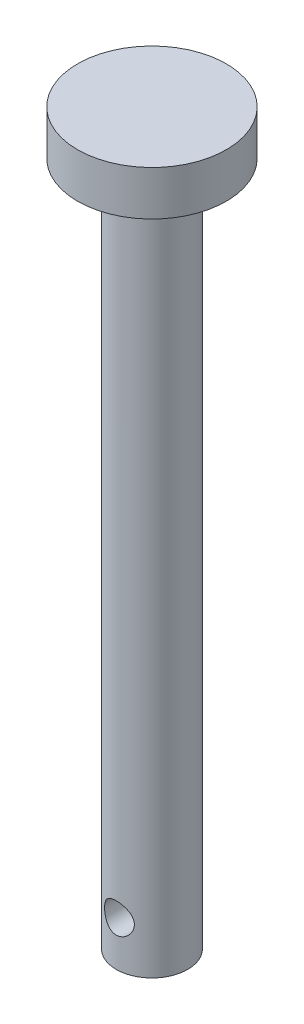
from build123d import *

# Parameters (mm, degrees)
SKETCH1_R               = 2.4
BOSS_EXTRUDE1_DEPTH     = 46
SKETCH2_R               = 5
BOSS_EXTRUDE2_DEPTH     = 3
CUT_EXTRUDE1_DEPTH      = 50.507575178
CUT_EXTRUDE1_DEPTH_BACK = 50.507575178
SKETCH3_R               = 1


with BuildPart() as part:
    # Sketch1 → Boss-Extrude1 (new body)
    with BuildSketch(Plane(origin=(0, 0, 0), x_dir=(1, 0, 0), z_dir=(0, 1, 0))):
        with Locations(Location((0, 0, 0), (0, 0, 270))):
            Circle(SKETCH1_R)
    extrude(amount=BOSS_EXTRUDE1_DEPTH)

    # Sketch2 → Boss-Extrude2 (add)
    with BuildSketch(Plane(origin=(0, 46, 0), x_dir=(1, 0, 0), z_dir=(0, 1, 0))):
        with Locations(Location((0, 0, 0), (0, 0, 270))):
            Circle(SKETCH2_R)
    extrude(amount=BOSS_EXTRUDE2_DEPTH)

    # Sketch3 → Cut-Extrude1 (cut, two sides: drawn at the far end of the back side and taken through both)
    with BuildSketch(Plane.XY.offset(-CUT_EXTRUDE1_DEPTH_BACK)):
        with Locations(Location((0, 3, 0), (0, 0, 90))):
            Circle(SKETCH3_R)
    extrude(amount=CUT_EXTRUDE1_DEPTH + CUT_EXTRUDE1_DEPTH_BACK, mode=Mode.SUBTRACT)


solid = part.part
